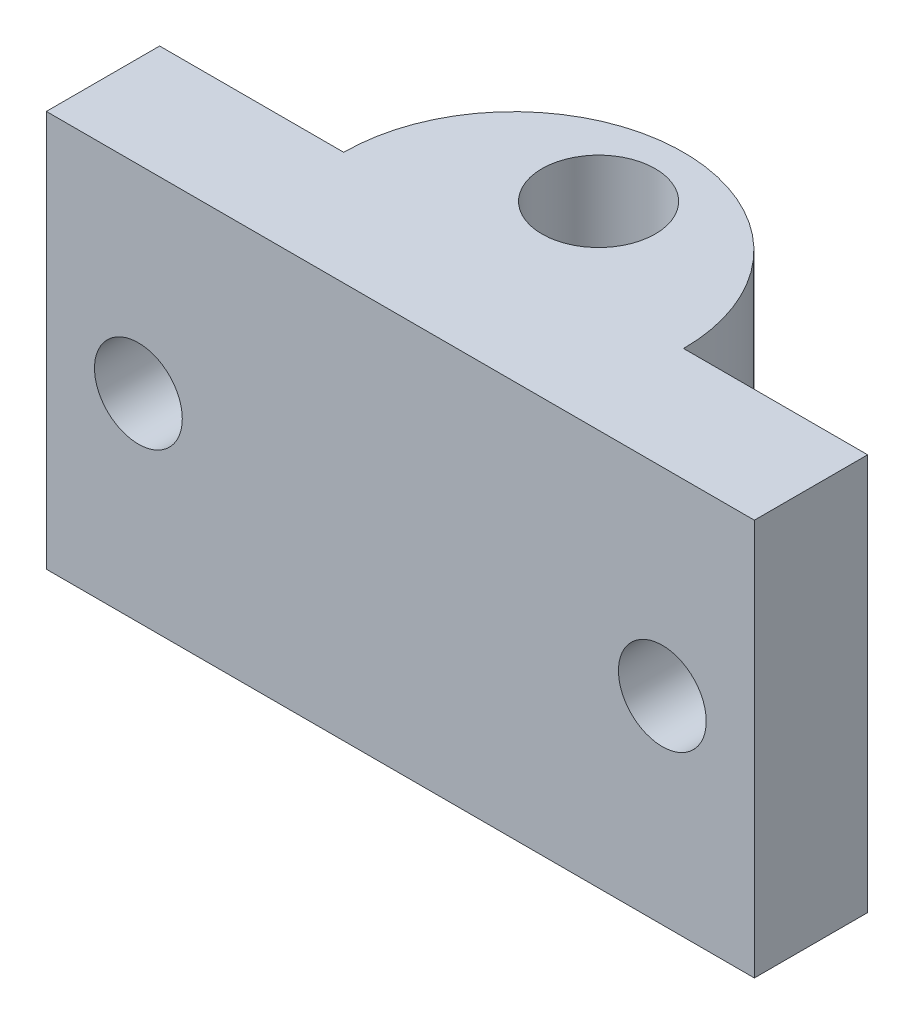
from build123d import *

# Parameters (mm, degrees)
SKETCH_1_W          = 50
SKETCH_1_H          = 28
EXTRUDE_1_DEPTH     = 8
EXTRUDE_2_DEPTH     = 28
CUT_EXTRUDE_1_DEPTH = 28
SKETCH_1_4_R        = 3.1
CUT_EXTRUDE_2_DEPTH = 8


with BuildPart() as part:
    # 草图1 → 凸台-拉伸1 (new body)
    with BuildSketch(Plane.XY):
        with Locations((25, -14)):
            Rectangle(SKETCH_1_W, SKETCH_1_H)
    extrude(amount=EXTRUDE_1_DEPTH)

    # 草图2 → 凸台-拉伸2 (add)
    with BuildSketch(Plane.XZ.offset(28)):
        with BuildLine():
            Line((37, 0), (25, 0))
            Line((25, 0), (13, 0))
            ThreePointArc((13, 0), (25, -12), (37, 0))
        make_face()
    extrude(amount=-EXTRUDE_2_DEPTH)

    # 草图3 → 切除-拉伸1 (cut)
    with BuildSketch(Plane.XZ.offset(28)):
        with BuildLine():
            ThreePointArc((25, -2), (21, -6), (25, -10))
            Line((25, -10), (25, -2))
        make_face()
        with BuildLine():
            Line((25, -2), (25, -10))
            ThreePointArc((25, -10), (27.828427125, -8.828427125), (29, -6))
            ThreePointArc((29, -6), (27.828427125, -3.171572875), (25, -2))
        make_face()
    extrude(amount=-CUT_EXTRUDE_1_DEPTH, mode=Mode.SUBTRACT)

    # 草图1<4> → 切除-拉伸2 (cut)
    with BuildSketch(Plane.XY):
        with Locations((6.5, -14)):
            Circle(SKETCH_1_4_R)
        with Locations((43.5, -14)):
            Circle(SKETCH_1_4_R)
    extrude(amount=CUT_EXTRUDE_2_DEPTH, mode=Mode.SUBTRACT)


solid = part.part
